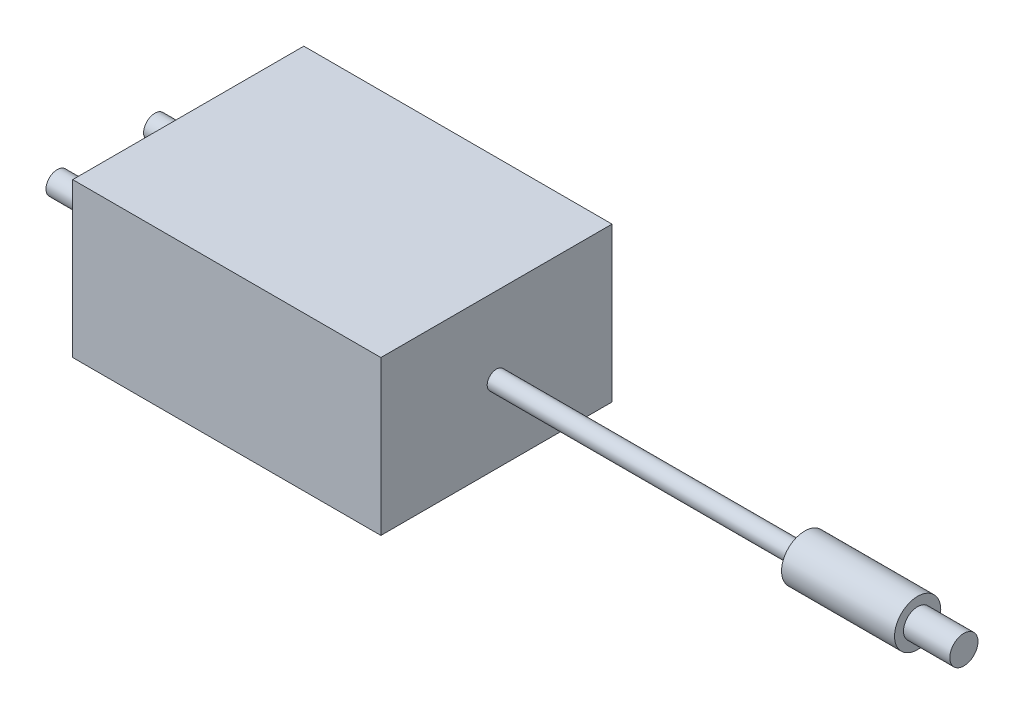
from build123d import *

# Parameters (mm, degrees)
SK_ADAPTER_BODY_W  = 60
SK_ADAPTER_BODY_H  = 45
ADAPTER_BODY_DEPTH = 30
MAINS_START        = -16
SK_MAINS_PINS_R    = 2.2
MAINS_PINS_DEPTH   = 16
MAINS_PINS_2_DEPTH = 16
DC_START           = 60
SK_DC_LEAD_R       = 1.8
DC_LEAD_DEPTH      = 60
BARREL_START       = 120
SK_BARREL_PLUG_R   = 4.5
BARREL_PLUG_DEPTH  = 22
PLUG_START         = 142
SK_PLUG_TIP_R      = 2.75
PLUG_TIP_DEPTH     = 9


with BuildPart() as part:
    # SK Adapter body → Adapter body (new body)
    with BuildSketch(Plane(origin=(0, 0, 0), x_dir=(1, 0, 0), z_dir=(0, 1, 0))):
        with Locations((30, 22.5)):
            Rectangle(SK_ADAPTER_BODY_W, SK_ADAPTER_BODY_H)
    extrude(amount=ADAPTER_BODY_DEPTH)


with BuildPart() as body_2:
    # SK Mains pins → Mains pins (new body)
    with BuildSketch(Plane(origin=(0, 0, 0), x_dir=(0, 0, -1), z_dir=(1, 0, 0)).offset(MAINS_START)):
        with Locations((13, 15)):
            Circle(SK_MAINS_PINS_R)
    extrude(amount=MAINS_PINS_DEPTH)


with BuildPart() as body_3:
    # SK Mains pins → Mains pins 2 (new body)
    with BuildSketch(Plane(origin=(0, 0, 0), x_dir=(0, 0, -1), z_dir=(1, 0, 0)).offset(MAINS_START)):
        with Locations((32, 15)):
            Circle(SK_MAINS_PINS_R)
    extrude(amount=MAINS_PINS_2_DEPTH)


with BuildPart() as body_4:
    # SK DC lead → DC lead (new body)
    with BuildSketch(Plane(origin=(0, 0, 0), x_dir=(0, 0, -1), z_dir=(1, 0, 0)).offset(DC_START)):
        with Locations((22.5, 15)):
            Circle(SK_DC_LEAD_R)
    extrude(amount=DC_LEAD_DEPTH)


with BuildPart() as body_5:
    # SK Barrel plug → Barrel plug (new body)
    with BuildSketch(Plane(origin=(0, 0, 0), x_dir=(0, 0, -1), z_dir=(1, 0, 0)).offset(BARREL_START)):
        with Locations((22.5, 15)):
            Circle(SK_BARREL_PLUG_R)
    extrude(amount=BARREL_PLUG_DEPTH)


with BuildPart() as body_6:
    # SK Plug tip → Plug tip (new body)
    with BuildSketch(Plane(origin=(0, 0, 0), x_dir=(0, 0, -1), z_dir=(1, 0, 0)).offset(PLUG_START)):
        with Locations((22.5, 15)):
            Circle(SK_PLUG_TIP_R)
    extrude(amount=PLUG_TIP_DEPTH)


solid = Compound([part.part, body_2.part, body_3.part, body_4.part, body_5.part, body_6.part])
